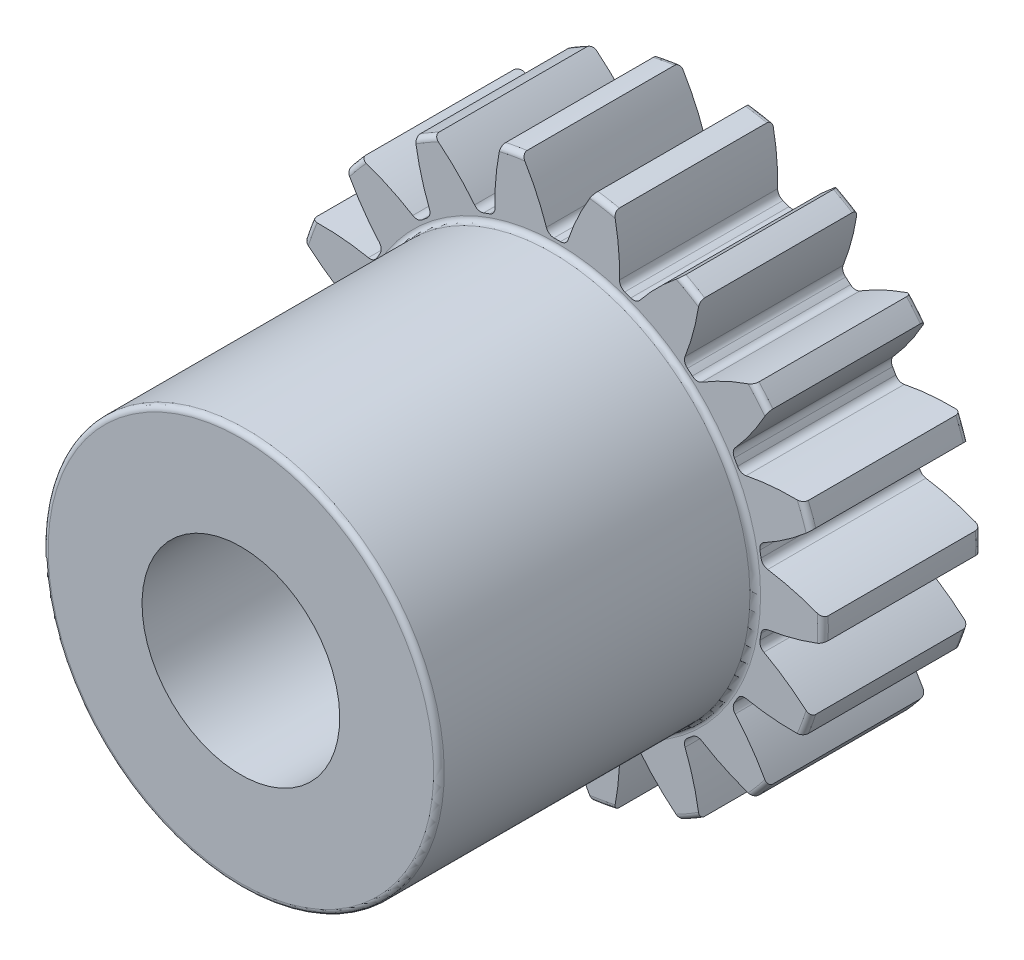
from build123d import *

# Parameters (mm, degrees)
FILLET2_R          = 0.10668
CUT_EXTRUDE2_DEPTH = 10.860304972
CIRPATTERN1_COUNT  = 18


with BuildPart() as part:
    # Sketch4 → Revolve1 (revolve)
    with BuildSketch(Plane(origin=(0, 0, 0), x_dir=(0, 0, -1), z_dir=(1, 0, 0))):
        Polygon((-9.525, 1.984375), (-9.525, 3.9751), (-3.175, 3.9751), (-3.175, 5.334), (0, 5.334), (0, 1.984375), align=None)
    revolve(axis=Axis((0, 0, 3.175), (0, 0, 1)))

    # Fillet2
    fillet2_edges = [part.edges().sort_by_distance(p)[0] for p in [
        (0, -5.334, 0),
        (0, -5.334, 3.175),
        (0, -3.9751, 3.175),
        (0, -3.9751, 9.525),
    ]]
    fillet(fillet2_edges, radius=FILLET2_R)

    # Sketch7 → Cut-Extrude2 (cut, through all)
    with BuildSketch(Plane.XY.offset(3.175)):
        with BuildLine():
            ThreePointArc((-0.064763188, 4.142868827), (0, 4.143375), (0.064763188, 4.142868827))
            ThreePointArc((0.064763188, 4.142868827), (0.158874403, 4.171960564), (0.217710969, 4.250963782))
            ThreePointArc((0.217710969, 4.250963782), (0.433564361, 4.783553385), (0.711994388, 5.286267113))
            ThreePointArc((0.711994388, 5.286267113), (0, 5.334), (-0.711994388, 5.286267113))
            ThreePointArc((-0.711994388, 5.286267113), (-0.433564361, 4.783553385), (-0.217710969, 4.250963782))
            ThreePointArc((-0.217710969, 4.250963782), (-0.158874403, 4.171960564), (-0.064763188, 4.142868827))
        make_face()
    cut_extrude2 = extrude(amount=-CUT_EXTRUDE2_DEPTH, mode=Mode.SUBTRACT)

    # CirPattern1: Cut-Extrude2 ×18 about axis
    cirpattern1_axis = Axis((0, 0, 0), (0, 0, 1))
    for i in range(1, CIRPATTERN1_COUNT):
        add(cut_extrude2.rotate(cirpattern1_axis, i * 360 / CIRPATTERN1_COUNT), mode=Mode.SUBTRACT)


solid = part.part
